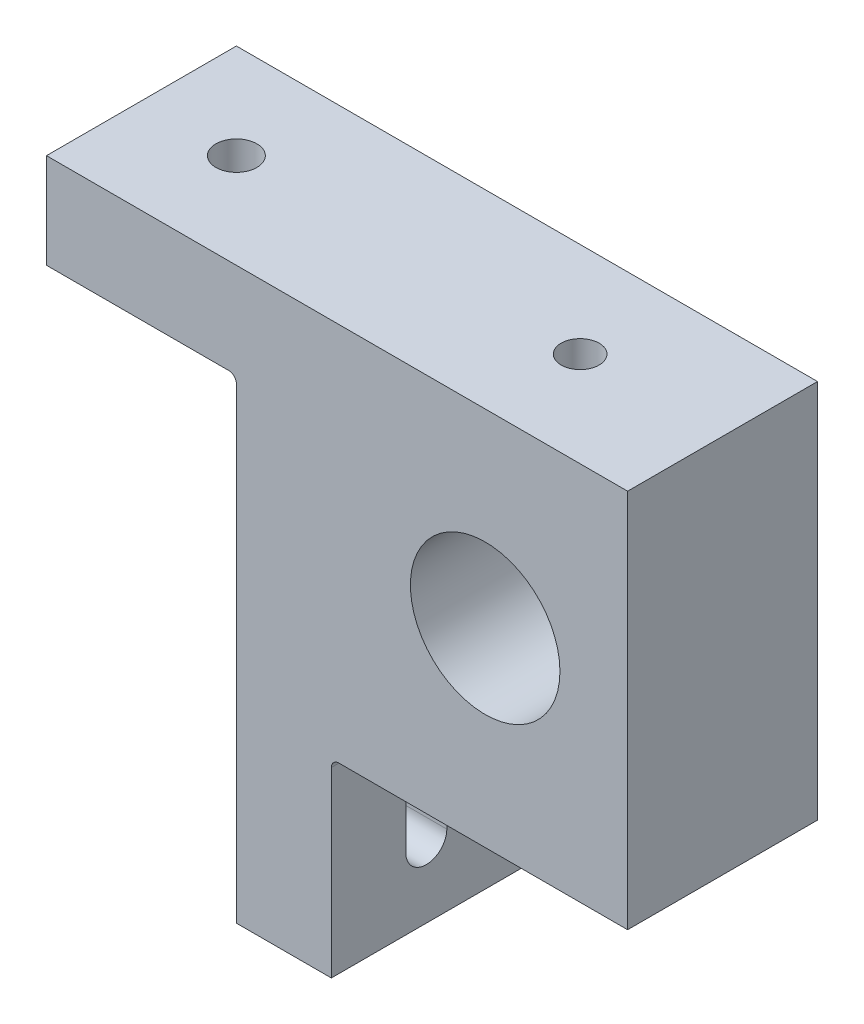
from build123d import *

# Parameters (mm, degrees)
SKETCH1_R           = 10
BOSS_EXTRUDE1_DEPTH = 25.4
CUT_EXTRUDE1_REACH  = 101.47
SKETCH2_R           = 2.7432
SKETCH2_R_2         = 2.54
CUT_EXTRUDE2_DEPTH  = 12.7
FILLET1_R           = 1.016


with BuildPart() as part:
    # Sketch1 → Boss-Extrude1 (new body)
    with BuildSketch(Plane.XY):
        Polygon((-58.674, 12.7), (-33.274, 12.7), (-33.274, -50.8), (-20.574, -50.8), (-20.574, -25.4), (19.05, -25.4), (19.05, 25.4), (-58.674, 25.4), align=None)
        Circle(SKETCH1_R, mode=Mode.SUBTRACT)
    extrude(amount=BOSS_EXTRUDE1_DEPTH)

    # Sketch2 → Cut-Extrude1 (cut, up to next)
    with BuildSketch(Plane(origin=(0, 25.4, 0), x_dir=(1, 0, 0), z_dir=(0, 1, 0)), mode=Mode.PRIVATE) as cut_extrude1_sk1:
        with Locations(Location((-45.974, -12.7, 0), (0, 0, 180))):
            Circle(SKETCH2_R)
    cut_extrude1_tool1 = extrude(cut_extrude1_sk1.sketch, amount=-CUT_EXTRUDE1_REACH, mode=Mode.PRIVATE) & part.part
    # Sketch2 → Cut-Extrude1 (cut, up to next)
    with BuildSketch(Plane(origin=(0, 25.4, 0), x_dir=(1, 0, 0), z_dir=(0, 1, 0)), mode=Mode.PRIVATE) as cut_extrude1_sk2:
        with Locations(Location((0, -12.7, 0), (0, 0, 180))):
            Circle(SKETCH2_R_2)
    cut_extrude1_tool2 = extrude(cut_extrude1_sk2.sketch, amount=-CUT_EXTRUDE1_REACH, mode=Mode.PRIVATE) & part.part
    add(cut_extrude1_tool1.solids().sort_by_distance((-45.974, 25.4, 12.7))[0], mode=Mode.SUBTRACT)
    add(cut_extrude1_tool2.solids().sort_by_distance((0, 25.4, 12.7))[0], mode=Mode.SUBTRACT)

    # Sketch3 → Cut-Extrude2 (cut)
    with BuildSketch(Plane(origin=(-20.574, 0, 0), x_dir=(0, 0, -1), z_dir=(1, 0, 0))):
        with BuildLine():
            Line((-9.9568, -34.925), (-9.9568, -41.275))
            ThreePointArc((-9.9568, -41.275), (-12.7, -44.0182), (-15.4432, -41.275))
            Line((-15.4432, -41.275), (-15.4432, -34.925))
            ThreePointArc((-15.4432, -34.925), (-12.7, -32.1818), (-9.9568, -34.925))
        make_face()
    extrude(amount=-CUT_EXTRUDE2_DEPTH, mode=Mode.SUBTRACT)

    # Fillet1
    fillet1_edges = [part.edges().sort_by_distance(p)[0] for p in [
        (-20.574, -25.4, 12.7),
        (-33.274, 12.7, 12.7),
    ]]
    fillet(fillet1_edges, radius=FILLET1_R)


solid = part.part
